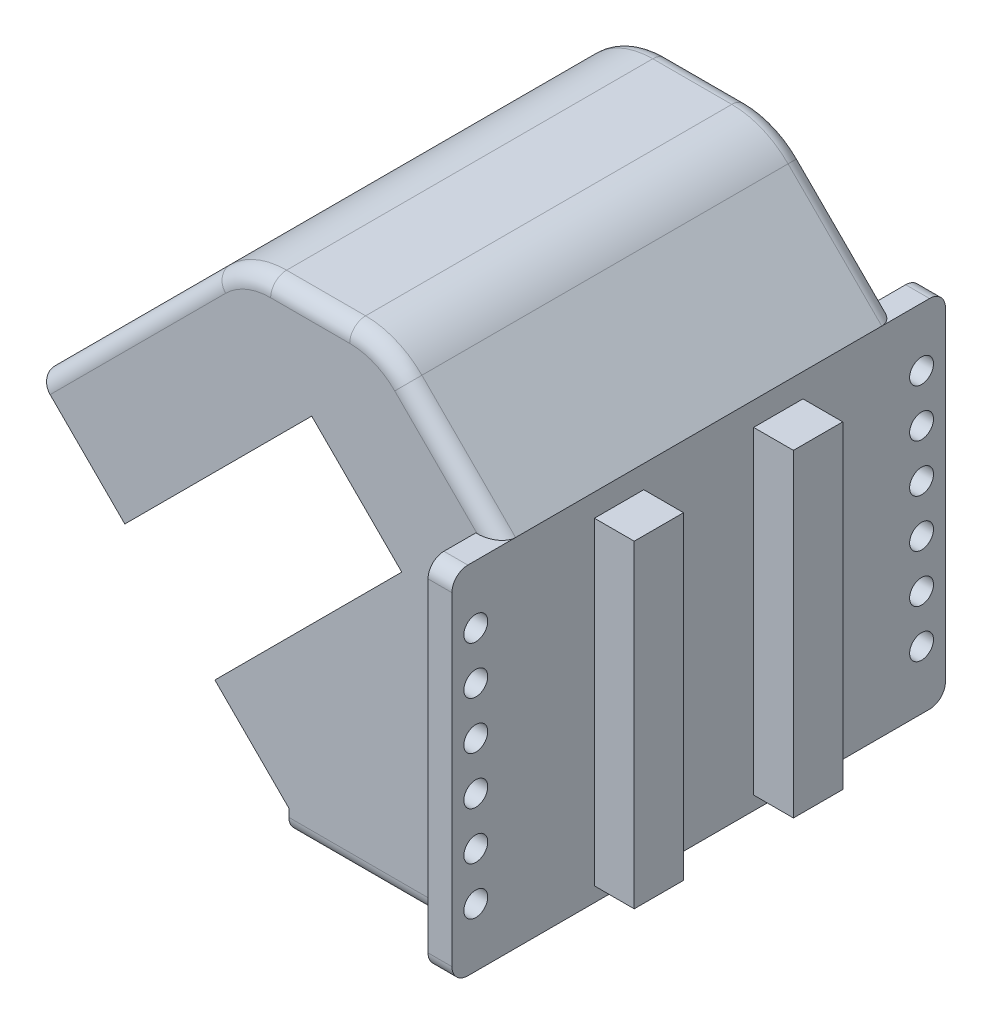
from build123d import *

# Parameters (mm, degrees)
EXTRUDE_1_DEPTH     = 50
EXTRUDE_3_DEPTH     = 33.199998
EXTRUDE_4_REACH     = 79.048
SKETCH_4_W          = 50
SKETCH_4_H          = 2.121320344
CUT_EXTRUDE_1_DEPTH = 99.405896905
SKETCH_8_W          = 62
SKETCH_8_H          = 44.689148571
SKETCH_8_R          = 1.5
EXTRUDE_5_DEPTH     = 3
FILLET_1_R          = 10
FILLET_2_R          = 2
SKETCH_9_W          = 6.2
SKETCH_9_H          = 40
EXTRUDE_6_DEPTH     = 5
SKETCH_10_W         = 6.2
SKETCH_10_H         = 40
EXTRUDE_7_DEPTH     = 5


with BuildPart() as part:
    # 草图1 → 凸台-拉伸1 (new body)
    with BuildSketch(Plane.XY):
        Polygon((25.716046069, 61.209761814), (43.929249505, 61.209761814), (58.626662914, 46.512348406), (58.626662914, 1.823199835), (32.150717778, 1.823199835), (32.150717778, 4.823199835), (55.626662914, 28.29914497), (25.716046069, 58.209761814), align=None)
    extrude(amount=EXTRUDE_1_DEPTH)

    # 草图3 → 凸台-拉伸3 (add)
    with BuildSketch(Plane(origin=(41.962903942, 41.962903942, 0), x_dir=(0, 0, 1), z_dir=(-0.7071067811865476, -0.7071067811865476, 0))):
        Polygon((50, -19.323473251), (46.15, -19.323473251), (43.15, -19.323473251), (46.15, -16.323473251), (46.15, 19.976526749), (43.15, 22.976526749), (46.15, 22.976526749), (50, 22.976526749), align=None)
        Polygon((0, 22.976526749), (0, -19.323473251), (3.85, -19.323473251), (6.85, -19.323473251), (3.85, -16.323473251), (3.85, 19.976526749), (6.85, 22.976526749), (3.85, 22.976526749), align=None)
    extrude(amount=EXTRUDE_3_DEPTH)

    # 凸台-拉伸4: up to this plane
    extrude_4_end = Plane(origin=(25.716046069, 61.209761814, 50), z_dir=(0, -1, 0))
    # 草图4 → 凸台-拉伸4 (add, up to the surface)
    with BuildSketch(Plane(origin=(18.486958806, 18.486958806, 0), x_dir=(0, 0, 1), z_dir=(-0.7071067811865477, -0.7071067811865475, 0)), mode=Mode.PRIVATE) as extrude_4_sk1:
        with Locations((25, 24.037186921)):
            Rectangle(SKETCH_4_W, SKETCH_4_H)
    extrude_4_tool1 = split(extrude(extrude_4_sk1.sketch, amount=-EXTRUDE_4_REACH, mode=Mode.PRIVATE), bisect_by=extrude_4_end, keep=Keep.BOTH, mode=Mode.PRIVATE)
    add(extrude_4_tool1.solids().sort_by_distance((1.490101, 35.483817, 25))[0])

    # 草图5 → 切除-拉伸1 (cut, through all)
    with BuildSketch(Plane(origin=(0, 0, 0), x_dir=(-1, 0, 0), z_dir=(0, 0, -1))):
        Polygon((-35.014500242, 48.911307642), (-46.328208741, 37.597599143), (-22.852263606, 14.121654007), (-11.538555107, 25.435362506), align=None)
    extrude(amount=-CUT_EXTRUDE_1_DEPTH, mode=Mode.SUBTRACT)

    # 草图8 → 凸台-拉伸5 (add)
    with BuildSketch(Plane(origin=(58.626662914, 0, 0), x_dir=(0, 0, -1), z_dir=(1, 0, 0))):
        with Locations((-25, 24.16777412)):
            Rectangle(SKETCH_8_W, SKETCH_8_H)
        with Locations(Location((-53, 39.162348406, 0), (0, 0, 90))):
            Circle(SKETCH_8_R, mode=Mode.SUBTRACT)
        with Locations(Location((-53, 33.162348406, 0), (0, 0, 90))):
            Circle(SKETCH_8_R, mode=Mode.SUBTRACT)
        with Locations(Location((-53, 27.162348406, 0), (0, 0, 90))):
            Circle(SKETCH_8_R, mode=Mode.SUBTRACT)
        with Locations(Location((-53, 21.162348406, 0), (0, 0, 90))):
            Circle(SKETCH_8_R, mode=Mode.SUBTRACT)
        with Locations(Location((-53, 15.162348406, 0), (0, 0, 90))):
            Circle(SKETCH_8_R, mode=Mode.SUBTRACT)
        with Locations(Location((-53, 9.162348406, 0), (0, 0, 90))):
            Circle(SKETCH_8_R, mode=Mode.SUBTRACT)
        with Locations(Location((3, 9.162348406, 0), (0, 0, 270))):
            Circle(SKETCH_8_R, mode=Mode.SUBTRACT)
        with Locations(Location((3, 15.162348406, 0), (0, 0, 270))):
            Circle(SKETCH_8_R, mode=Mode.SUBTRACT)
        with Locations(Location((3, 21.162348406, 0), (0, 0, 270))):
            Circle(SKETCH_8_R, mode=Mode.SUBTRACT)
        with Locations(Location((3, 27.162348406, 0), (0, 0, 270))):
            Circle(SKETCH_8_R, mode=Mode.SUBTRACT)
        with Locations(Location((3, 33.162348406, 0), (0, 0, 270))):
            Circle(SKETCH_8_R, mode=Mode.SUBTRACT)
        with Locations(Location((3, 39.162348406, 0), (0, 0, 270))):
            Circle(SKETCH_8_R, mode=Mode.SUBTRACT)
    extrude(amount=-EXTRUDE_5_DEPTH)

    # 圆角1
    fillet_1_edges = [part.edges().sort_by_distance(p)[0] for p in [
        (25.716046069, 61.209761814, 25),
        (43.929249505, 61.209761814, 25),
    ]]
    fillet(fillet_1_edges, radius=FILLET_1_R)

    # 圆角2
    fillet_2_edges = [part.edges().sort_by_distance(p)[0] for p in [
        (52.742422303, 52.396589016, 0),
        (57.126662914, 1.823199835, -6),
        (57.126662914, 1.823199835, 56),
        (57.126662914, 46.512348406, 56),
        (57.126662914, 46.512348406, -6),
        (34.822647787, 61.209761814, 0),
        (34.822647787, 61.209761814, 50),
        (11.763607408, 47.257323152, 0),
        (26.031347369, 60.448557139, 0),
        (43.613948205, 60.448557139, 0),
        (11.763607408, 47.257323152, 50),
        (26.031347369, 60.448557139, 50),
        (43.613948205, 60.448557139, 50),
        (43.888690346, 1.823199835, 50),
        (43.888690346, 1.823199835, 0),
        (52.742422303, 52.396589016, 50),
    ]]
    fillet(fillet_2_edges, radius=FILLET_2_R)

    # 草图9 → 凸台-拉伸6 (add)
    with BuildSketch(Plane(origin=(58.626662914, 0, 0), x_dir=(0, 0, -1), z_dir=(1, 0, 0))):
        with Locations((-34.99740251, 23.658233783)):
            Rectangle(SKETCH_9_W, SKETCH_9_H)
    extrude(amount=EXTRUDE_6_DEPTH)

    # 草图10 → 凸台-拉伸7 (add)
    with BuildSketch(Plane(origin=(58.626662914, 0, 0), x_dir=(0, 0, -1), z_dir=(1, 0, 0))):
        with Locations((-14.997806006, 23.541157616)):
            Rectangle(SKETCH_10_W, SKETCH_10_H)
    extrude(amount=EXTRUDE_7_DEPTH)


solid = part.part
